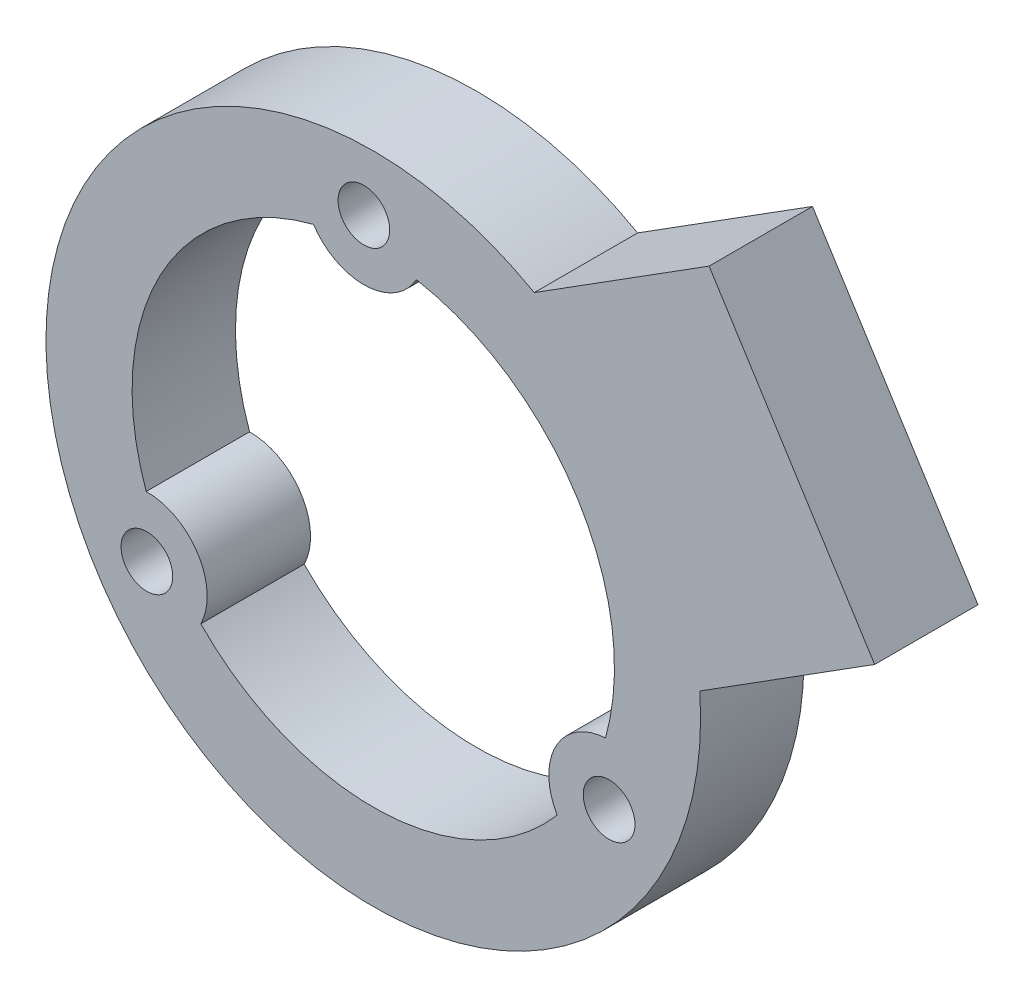
from build123d import *

# Parameters (mm, degrees)
ESQUISSE1_R        = 1.5
BOSS_EXTRU_3_DEPTH = 6


with BuildPart() as part:
    # Esquisse1 → Boss.-Extru.3 (new body)
    with BuildSketch(Plane.XY):
        with BuildLine():
            Line((29.100926589, 7.727116755), (19.492495604, 22.948090903))
            Line((19.492495604, 22.948090903), (9.344755552, 16.543141892))
            ThreePointArc((9.344755552, 16.543141892), (-16.066583823, -10.142232706), (18.954034468, 1.320824515))
            Line((18.954034468, 1.320824515), (29.100926589, 7.727116755))
        make_face()
        with Locations((-0.546712729, 15.490355231)):
            Circle(ESQUISSE1_R, mode=Mode.SUBTRACT)
        with Locations((-13.14168478, -8.218644727)):
            Circle(ESQUISSE1_R, mode=Mode.SUBTRACT)
        with Locations((13.688397508, -7.271710504)):
            Circle(ESQUISSE1_R, mode=Mode.SUBTRACT)
        with BuildLine():
            ThreePointArc((-3.468577117, 13.56351624), (-0.423261467, 11.992533082), (2.503723019, 13.774301109))
            ThreePointArc((2.503723019, 13.774301109), (11.869908833, 7.423292012), (13.480638187, -3.777882222))
            ThreePointArc((13.480638187, -3.777882222), (10.597469039, -5.629711358), (10.677033171, -9.055438293))
            ThreePointArc((10.677033171, -9.055438293), (0.493805045, -13.991288596), (-10.01206107, -9.785634018))
            ThreePointArc((-10.01206107, -9.785634018), (-10.174207571, -6.362821724), (-13.180756189, -4.718862816))
            ThreePointArc((-13.180756189, -4.718862816), (-12.363713879, 6.567996584), (-3.468577117, 13.56351624))
        make_face(mode=Mode.SUBTRACT)
    extrude(amount=BOSS_EXTRU_3_DEPTH)


solid = part.part
